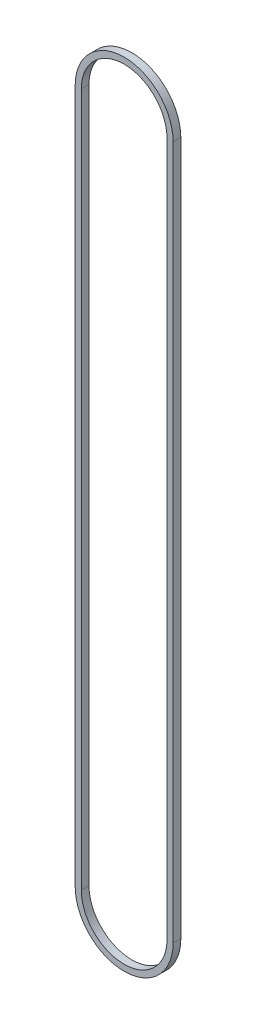
from build123d import *

# Parameters (mm, degrees)
BOSS_EXTRUDE1_DEPTH = 18.82


with BuildPart() as part:
    # Sketch1 → Boss-Extrude1 (new body)
    with BuildSketch(Plane.XY):
        with BuildLine():
            Line((120, 850), (120, -850))
            ThreePointArc((120, -850), (0, -970), (-120, -850))
            Line((-120, -850), (-120, 850))
            ThreePointArc((-120, 850), (0, 970), (120, 850))
        make_face()
        with BuildLine():
            Line((105, 850), (105, -850))
            ThreePointArc((105, -850), (0, -955), (-105, -850))
            Line((-105, -850), (-105, 850))
            ThreePointArc((-105, 850), (0, 955), (105, 850))
        make_face(mode=Mode.SUBTRACT)
    extrude(amount=BOSS_EXTRUDE1_DEPTH)


solid = part.part
